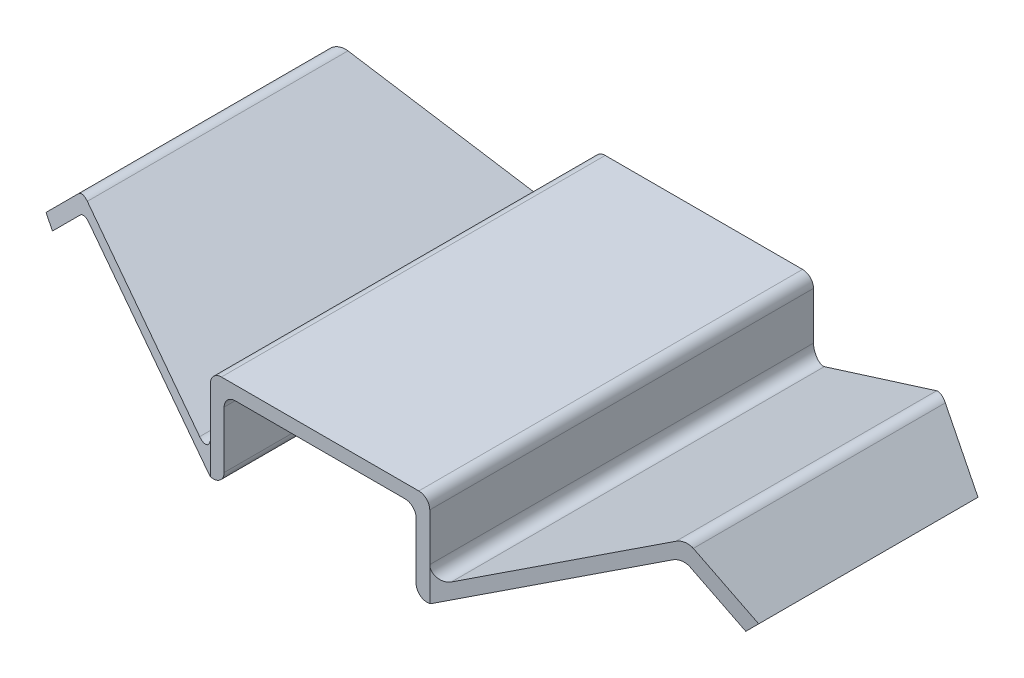
from build123d import *

# Parameters (mm, degrees)
BOSS_EXTRUDE1_DEPTH  = 1.75
CUT_EXTRUDE1_DEPTH   = 4.801744338
MIRROR2_COPY_1_DEPTH = 4.801744338
FILLET1_R            = 0.1


with BuildPart() as part:
    # Sketch1 → Boss-Extrude1 (new, symmetric)
    with BuildSketch(Plane.XY):
        Polygon((-1, 0), (1, 0), (1, -0.7), (2.75, 0.25), (3.25, -0.25), (3.161611652, -0.338388348), (2.727609122, 0.095614182), (0.875, -0.910087913), (0.875, -0.125), (-0.875, -0.125), (-0.875, -0.910087913), (-2.727609122, 0.095614182), (-3.161611652, -0.338388348), (-3.25, -0.25), (-2.75, 0.25), (-1, -0.7), align=None)
    extrude(amount=BOSS_EXTRUDE1_DEPTH, both=True)

    # Sketch2 → Cut-Extrude1 (cut, symmetric)
    with BuildSketch(Plane(origin=(0, 0, 0), x_dir=(1, 0, 0), z_dir=(0, 1, 0))):
        Polygon((-3.25, 1), (-1, 1.75), (-3.25, 1.75), align=None)
    cut_extrude1 = extrude(amount=CUT_EXTRUDE1_DEPTH, both=True, mode=Mode.SUBTRACT)

    # Mirror1: Cut-Extrude1 across plane
    add(cut_extrude1.mirror(Plane.XY), mode=Mode.SUBTRACT)

    # Mirror2: Cut-Extrude1 across plane
    add(cut_extrude1.mirror(Plane(origin=(0, 0, 0), x_dir=(0, 0, 1), z_dir=(1, 0, 0))), mode=Mode.SUBTRACT)

    # Mirror2 copy 1 sketch → Mirror2 copy 1 (cut, symmetric)
    with BuildSketch(Plane(origin=(0, 0, 0), x_dir=(-1, 0, 0), z_dir=(0, 1, 0))):
        Polygon((-3.25, 1), (-1, 1.75), (-3.25, 1.75), align=None)
    extrude(amount=MIRROR2_COPY_1_DEPTH, both=True, mode=Mode.SUBTRACT)

    # Fillet1
    fillet1_edges = [part.edges().sort_by_distance(p)[0] for p in [
        (1, 0, 0),
        (-1, 0, 0),
        (0.875, -0.125, 0),
        (-0.875, -0.125, 0),
        (0.875, -0.910087913, 0),
        (-0.875, -0.910087913, 0),
        (2.727609122, 0.095614182, 0),
        (-2.727609122, 0.095614182, 0),
        (2.75, 0.25, 0),
        (-2.75, 0.25, 0),
        (1, -0.7, 0),
        (-1, -0.7, 0),
    ]]
    fillet(fillet1_edges, radius=FILLET1_R)


solid = part.part
